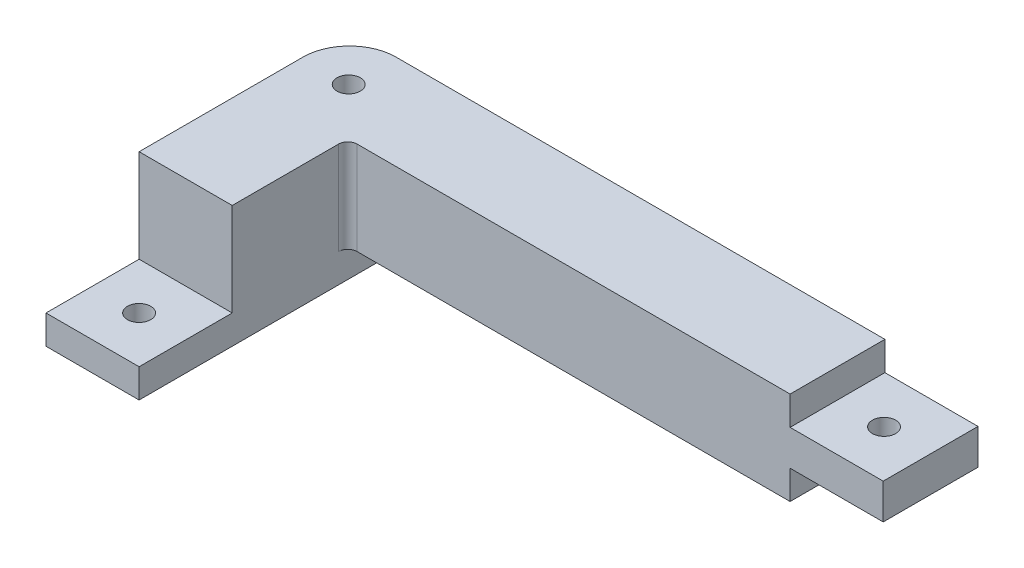
from build123d import *

# Parameters (mm, degrees)
SKETCH1_W           = 25.4
SKETCH1_H           = 82.804
BOSS_EXTRUDE1_DEPTH = 33.274
SKETCH3_W           = 25.859634715
SKETCH3_H           = 25.4
BOSS_EXTRUDE2_DEPTH = 120.65
SKETCH4_W           = 25.4
SKETCH4_H           = 25.4
CUT_EXTRUDE2_DEPTH  = 25.4
SKETCH5_W           = 25.859634715
SKETCH5_H           = 9.652
BOSS_EXTRUDE3_DEPTH = 25.4
SKETCH7_R           = 3.175
CUT_EXTRUDE4_DEPTH  = 41.402
SKETCH8_R           = 3.175
CUT_EXTRUDE5_DEPTH  = 25.4
SKETCH6_R           = 3.175
CUT_EXTRUDE3_DEPTH  = 41.402
FILLET1_R           = 12.7
FILLET2_R           = 2.54


with BuildPart() as part:
    # Sketch1 → Boss-Extrude1 (new body)
    with BuildSketch(Plane(origin=(0, 0, 0), x_dir=(1, 0, 0), z_dir=(0, 1, 0))):
        with Locations((13.650196891, -15.542365285)):
            Rectangle(SKETCH1_W, SKETCH1_H)
    extrude(amount=BOSS_EXTRUDE1_DEPTH)

    # Sketch3 → Boss-Extrude2 (add)
    with BuildSketch(Plane(origin=(26.350196891, 0, 0), x_dir=(0, 0, -1), z_dir=(1, 0, 0))):
        with Locations((12.929817358, 20.574)):
            Rectangle(SKETCH3_W, SKETCH3_H)
    extrude(amount=BOSS_EXTRUDE2_DEPTH)

    # Sketch4 → Cut-Extrude2 (cut)
    with BuildSketch(Plane.XY.offset(56.944365285)):
        with Locations((13.650196891, 20.574)):
            Rectangle(SKETCH4_W, SKETCH4_H)
    extrude(amount=-CUT_EXTRUDE2_DEPTH, mode=Mode.SUBTRACT)

    # Sketch5 → Boss-Extrude3 (add)
    with BuildSketch(Plane(origin=(147.000196891, 0, 0), x_dir=(0, 0, -1), z_dir=(1, 0, 0))):
        with Locations((12.929817358, 20.574)):
            Rectangle(SKETCH5_W, SKETCH5_H)
    extrude(amount=BOSS_EXTRUDE3_DEPTH)

    # Sketch7 → Cut-Extrude4 (cut)
    with BuildSketch(Plane(origin=(0, 25.4, 0), x_dir=(1, 0, 0), z_dir=(0, 1, 0))):
        with Locations(Location((159.700196891, 12.929817358, 0), (0, 0, 270))):
            Circle(SKETCH7_R)
    extrude(amount=-CUT_EXTRUDE4_DEPTH, mode=Mode.SUBTRACT)

    # Sketch8 → Cut-Extrude5 (cut)
    with BuildSketch(Plane(origin=(0, 7.874, 0), x_dir=(1, 0, 0), z_dir=(0, 1, 0))):
        with Locations(Location((13.650196891, -44.244365285, 0), (0, 0, 270))):
            Circle(SKETCH8_R)
    extrude(amount=-CUT_EXTRUDE5_DEPTH, mode=Mode.SUBTRACT)

    # Sketch6 → Cut-Extrude3 (cut)
    with BuildSketch(Plane(origin=(0, 33.274, 0), x_dir=(1, 0, 0), z_dir=(0, 1, 0))):
        with Locations(Location((13.650196891, 12.929817358, 0), (0, 0, 270))):
            Circle(SKETCH6_R)
    extrude(amount=-CUT_EXTRUDE3_DEPTH, mode=Mode.SUBTRACT)

    # Fillet1
    fillet1_edges = [part.edges().sort_by_distance(p)[0] for p in [
        (0.950196891, 16.637, -25.859634715),
    ]]
    fillet(fillet1_edges, radius=FILLET1_R)

    # Fillet2
    fillet2_edges = [part.edges().sort_by_distance(p)[0] for p in [
        (26.350196891, 20.574, 0),
    ]]
    fillet(fillet2_edges, radius=FILLET2_R)


solid = part.part
